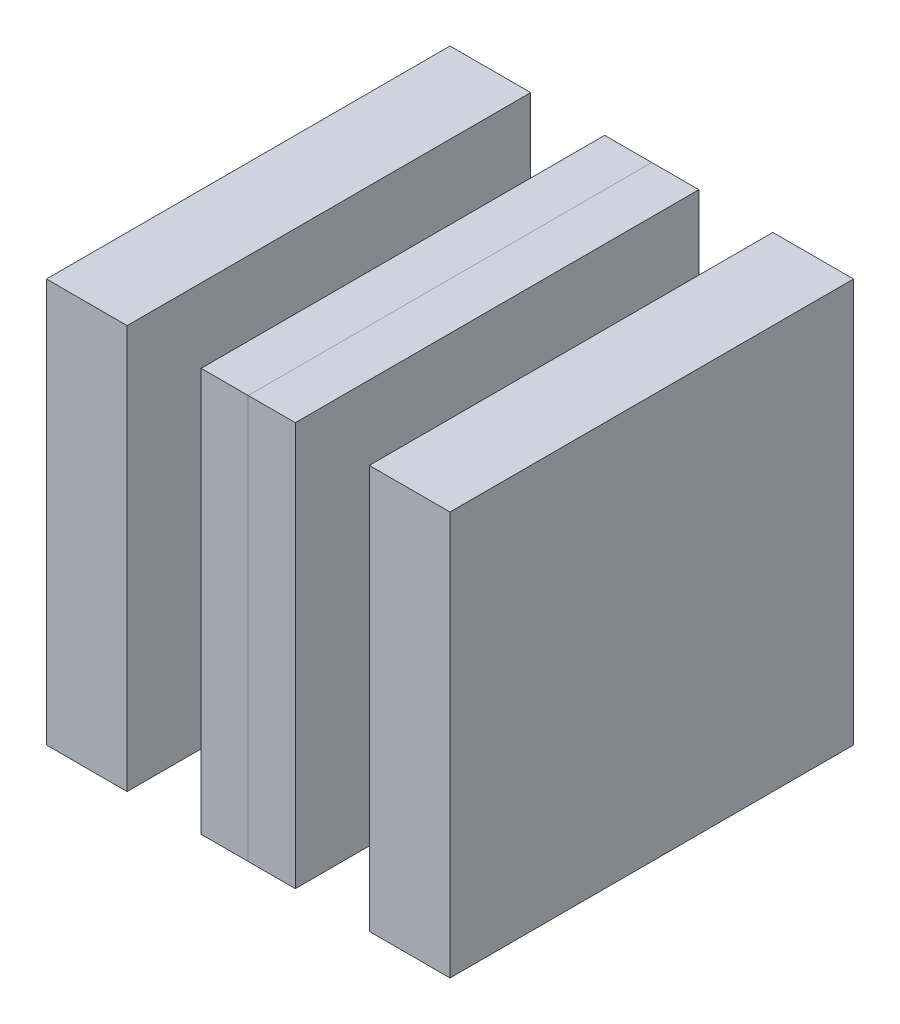
from build123d import *

# Parameters (mm, degrees)
SKETCH1_W             = 3
SKETCH1_H             = 15
BOSS_EXTRUDE1_DEPTH   = 15
SKETCH1_W_2           = 1.75
BOSS_EXTRUDE1_2_DEPTH = 15


with BuildPart() as part:
    # Sketch1 → Boss-Extrude1 (new body)
    with BuildSketch(Plane.XY):
        with Locations((1.5, 7.5)):
            Rectangle(SKETCH1_W, SKETCH1_H)
    extrude(amount=BOSS_EXTRUDE1_DEPTH)


with BuildPart() as body_2:
    # Sketch1 → Boss-Extrude1 2 (new body)
    with BuildSketch(Plane.XY):
        with Locations((6.625, 7.5)):
            Rectangle(SKETCH1_W_2, SKETCH1_H)
    extrude(amount=BOSS_EXTRUDE1_2_DEPTH)


with BuildPart() as body_3:
    # Mirror1: mirrored copy
    add(body_2.part.mirror(Plane(origin=(7.5, 15, 15), x_dir=(0, 0, 1), z_dir=(-1, 0, 0))))


with BuildPart() as body_4:
    # Mirror1 2: mirrored copy
    add(part.part.mirror(Plane(origin=(7.5, 15, 15), x_dir=(0, 0, 1), z_dir=(-1, 0, 0))))


solid = Compound([part.part, body_2.part, body_3.part, body_4.part])
